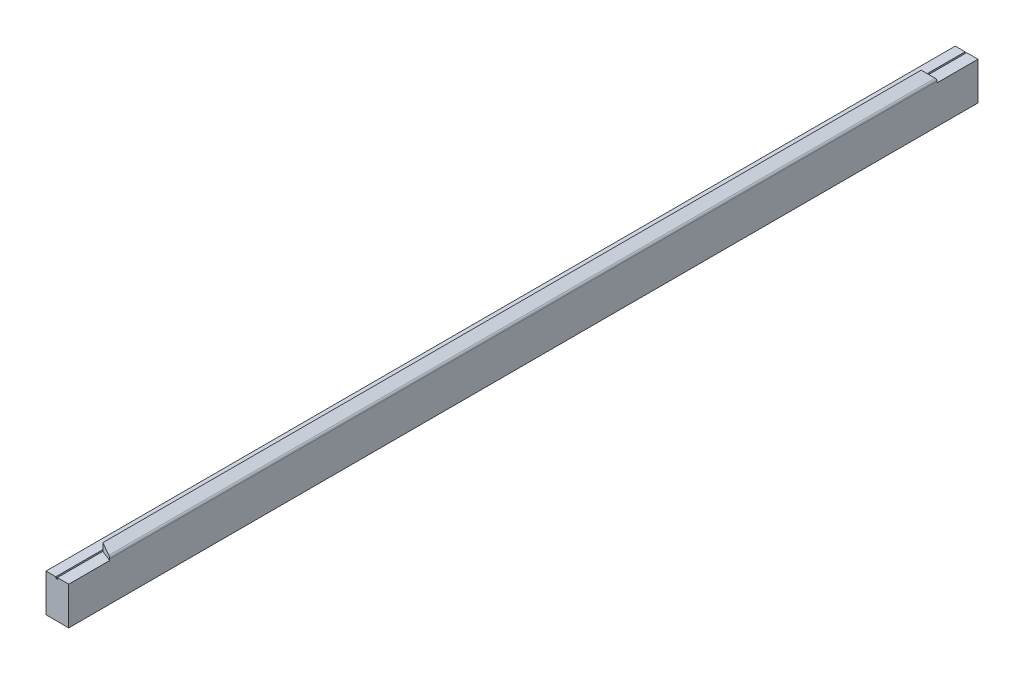
from build123d import *

# Parameters (mm, degrees)
ESQUISSE1_W                  = 30
ESQUISSE1_H                  = 60
BOSS_EXTRU_1_DEPTH           = 1200
ENL_V_MAT_EXTRU_4_DEPTH      = 1202.873537441
ENL_V_MAT_EXTRU_4_DEPTH_BACK = 1202.873537441
ESQUISSE5_W                  = 15
ESQUISSE5_H                  = 10
ENL_V_MAT_EXTRU_2_DEPTH      = 1202.873537441
ENL_V_MAT_EXTRU_2_DEPTH_BACK = 1202.873537441
CONG_1_R                     = 3
ENL_V_MAT_EXTRU_5_REACH      = 1203.416
ESQUISSE7_W                  = 2
ESQUISSE7_H                  = 1200
ENL_V_MAT_EXTRU_6_DEPTH      = 2


with BuildPart() as part:
    # Esquisse1 → Boss.-Extru.1 (new body)
    with BuildSketch(Plane.XY):
        with Locations((15, 30)):
            Rectangle(ESQUISSE1_W, ESQUISSE1_H)
    extrude(amount=BOSS_EXTRU_1_DEPTH)

    # Esquisse5 → Enlèv. mat.-Extru.4 (cut, two sides: drawn at the far end of the back side and taken through both)
    with BuildSketch(Plane.XY.offset(1200).offset(-ENL_V_MAT_EXTRU_4_DEPTH_BACK)):
        with Locations((7.5, 55)):
            Rectangle(ESQUISSE5_W, ESQUISSE5_H)
    extrude(amount=ENL_V_MAT_EXTRU_4_DEPTH + ENL_V_MAT_EXTRU_4_DEPTH_BACK, mode=Mode.SUBTRACT)

    # Esquisse3 → Enlèv. mat.-Extru.2 (cut, two sides: drawn at the far end of the back side and taken through both)
    with BuildSketch(Plane.XY.offset(1200).offset(-ENL_V_MAT_EXTRU_2_DEPTH_BACK)):
        Polygon((15, 60), (30, 54), (30, 60), align=None)
    extrude(amount=ENL_V_MAT_EXTRU_2_DEPTH + ENL_V_MAT_EXTRU_2_DEPTH_BACK, mode=Mode.SUBTRACT)

    # Congé1
    cong_1_edges = [part.edges().sort_by_distance(p)[0] for p in [
        (30, 54, 600),
    ]]
    fillet(cong_1_edges, radius=CONG_1_R)

    # Enlèv. mat.-Extru.5: up to this plane
    enl_v_mat_extru_5_end = Plane(origin=(15, 60, 0), z_dir=(-0.37139067635410367, -0.9284766908852594, 0))
    # Esquisse6 → Enlèv. mat.-Extru.5 (cut, up to the surface)
    with BuildSketch(Plane(origin=(0, 50, 0), x_dir=(1, 0, 0), z_dir=(0, 1, 0)), mode=Mode.PRIVATE) as enl_v_mat_extru_5_sk1:
        Polygon((0, -1200), (30, -1200), (30, -1146), (15, -1140), (0, -1140), align=None)
    enl_v_mat_extru_5_tool1 = split(extrude(enl_v_mat_extru_5_sk1.sketch, amount=ENL_V_MAT_EXTRU_5_REACH, mode=Mode.PRIVATE), bisect_by=enl_v_mat_extru_5_end, keep=Keep.BOTH, mode=Mode.PRIVATE)
    add(enl_v_mat_extru_5_tool1.solids().sort_by_distance((14.74359, 50, 1170.717949))[0], mode=Mode.SUBTRACT)
    # Esquisse6 → Enlèv. mat.-Extru.5 (cut, up to the surface)
    with BuildSketch(Plane(origin=(0, 50, 0), x_dir=(1, 0, 0), z_dir=(0, 1, 0)), mode=Mode.PRIVATE) as enl_v_mat_extru_5_sk2:
        Polygon((0, -60), (0, 0), (30, 0), (30, -54), (15, -60), align=None)
    enl_v_mat_extru_5_tool2 = split(extrude(enl_v_mat_extru_5_sk2.sketch, amount=ENL_V_MAT_EXTRU_5_REACH, mode=Mode.PRIVATE), bisect_by=enl_v_mat_extru_5_end, keep=Keep.BOTH, mode=Mode.PRIVATE)
    add(enl_v_mat_extru_5_tool2.solids().sort_by_distance((14.74359, 50, 29.282051))[0], mode=Mode.SUBTRACT)

    # Esquisse7 → Enlèv. mat.-Extru.6 (cut)
    with BuildSketch(Plane(origin=(0, 50, 0), x_dir=(1, 0, 0), z_dir=(0, 1, 0))):
        with Locations((14, -600)):
            Rectangle(ESQUISSE7_W, ESQUISSE7_H)
    extrude(amount=-ENL_V_MAT_EXTRU_6_DEPTH, mode=Mode.SUBTRACT)


solid = part.part
